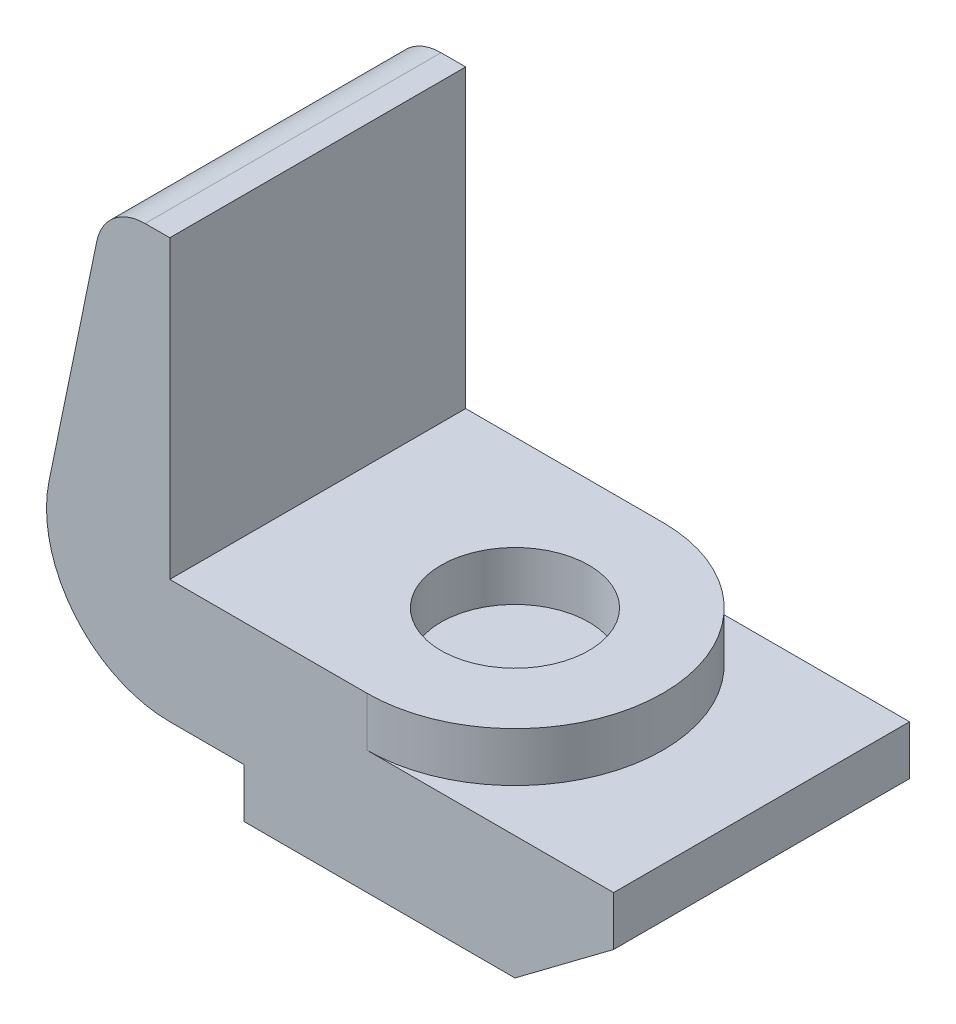
from build123d import *

# Parameters (mm, degrees)
BOSS_EXTRUDE1_DEPTH = 76.2
SKETCH3_R           = 38.1
BOSS_EXTRUDE2_DEPTH = 12.7
SKETCH4_R           = 19.05
CUT_EXTRUDE1_DEPTH  = 12.7


with BuildPart() as part:
    # Sketch1 → Boss-Extrude1 (new body)
    with BuildSketch(Plane.XY):
        with BuildLine():
            Line((0, 0), (69.85, 0))
            Line((69.85, 0), (95.25, 19.05))
            Line((95.25, 19.05), (95.25, 31.75))
            Line((95.25, 31.75), (31.75, 31.75))
            Line((31.75, 31.75), (31.75, 44.45))
            Line((31.75, 44.45), (-19.05, 44.45))
            Line((-19.05, 44.45), (-19.05, 120.65))
            Line((-19.05, 120.65), (-25.4, 120.65))
            ThreePointArc((-25.4, 120.65), (-33.421823369, 117.795829058), (-37.838031752, 110.516196825))
            Line((-37.838031752, 110.516196825), (-50.145079379, 50.865492062))
            ThreePointArc((-50.145079379, 50.865492062), (-43.664572645, 24.395441578), (-19.05, 12.7))
            Line((-19.05, 12.7), (0, 12.7))
            Line((0, 12.7), (0, 0))
        make_face()
    extrude(amount=BOSS_EXTRUDE1_DEPTH)

    # Sketch3 → Boss-Extrude2 (add)
    with BuildSketch(Plane(origin=(0, 31.75, 0), x_dir=(1, 0, 0), z_dir=(0, 1, 0))):
        with Locations((31.75, -38.1)):
            Circle(SKETCH3_R)
    extrude(amount=BOSS_EXTRUDE2_DEPTH)

    # Sketch4 → Cut-Extrude1 (cut)
    with BuildSketch(Plane(origin=(0, 44.45, 0), x_dir=(1, 0, 0), z_dir=(0, 1, 0))):
        with Locations(Location((31.75, -38.1, 0), (0, 0, 180))):
            Circle(SKETCH4_R)
    extrude(amount=-CUT_EXTRUDE1_DEPTH, mode=Mode.SUBTRACT)


solid = part.part
